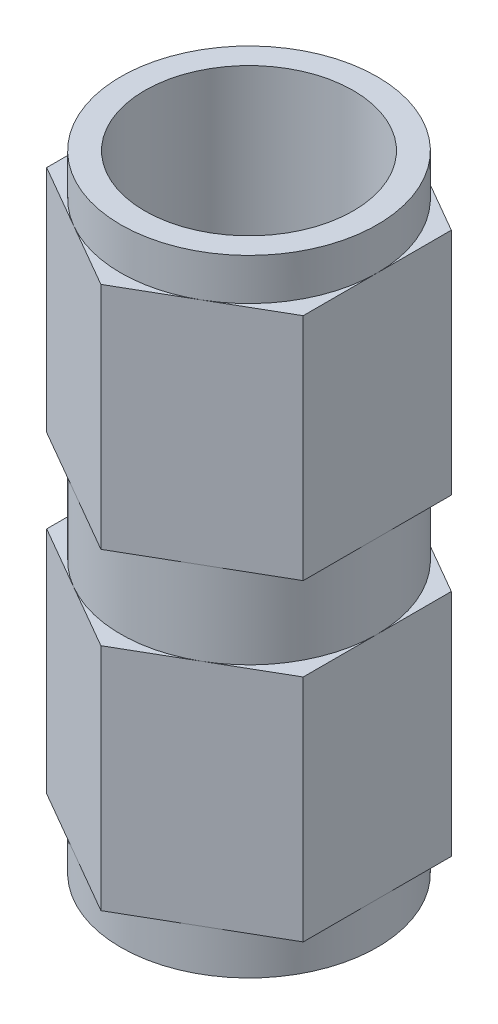
from build123d import *

# Parameters (mm, degrees)
SKETCH1_R               = 6.35
BOSS_EXTRUDE1_DEPTH     = 38.1
CUT_EXTRUDE1_DEPTH      = 2.54
CUT_EXTRUDE2_START      = -2.54
CUT_EXTRUDE2_DEPTH      = 2.54
CUT_EXTRUDE3_DEPTH      = 2.54
CUT_EXTRUDE3_DEPTH_BACK = 2.54
SKETCH5_R               = 11.357347969
SKETCH5_R_2             = 7.808951066


with BuildPart() as part:
    # Sketch1 → Boss-Extrude1 (new body)
    with BuildSketch(Plane(origin=(0, 0, 0), x_dir=(1, 0, 0), z_dir=(0, 1, 0))):
        Polygon((0, 9.017), (-7.808951066, 4.5085), (-7.808951066, -4.5085), (0, -9.017), (7.808951066, -4.5085), (7.808951066, 4.5085), align=None)
        with Locations(Location((0, 0, 0), (0, 0, 90))):
            Circle(SKETCH1_R, mode=Mode.SUBTRACT)
    extrude(amount=BOSS_EXTRUDE1_DEPTH)

    # Sketch3 → Cut-Extrude1 (cut)
    with BuildSketch(Plane.XZ):
        with BuildLine():
            Line((7.808951066, -4.5085), (7.808951066, 0))
            ThreePointArc((7.808951066, 0), (6.762749987, -3.904475555), (3.904475488, -6.762750026))
            Line((3.904475488, -6.762750026), (7.808951066, -4.5085))
        make_face()
        with BuildLine():
            ThreePointArc((3.904475554, 6.762749988), (6.762750006, 3.904475522), (7.808951066, 0))
            Line((7.808951066, 0), (7.808951066, 4.5085))
            Line((7.808951066, 4.5085), (3.904475554, 6.762749988))
        make_face()
        with BuildLine():
            ThreePointArc((-3.904475468, 6.762750038), (5e-08, 7.808951066), (3.904475554, 6.762749988))
            Line((3.904475554, 6.762749988), (0, 9.017))
            Line((0, 9.017), (-3.904475468, 6.762750038))
        make_face()
        with BuildLine():
            Line((0, -9.017), (3.904475488, -6.762750026))
            ThreePointArc((3.904475488, -6.762750026), (-3.8e-08, -7.808951066), (-3.904475554, -6.762749988))
            Line((-3.904475554, -6.762749988), (0, -9.017))
        make_face()
        with BuildLine():
            ThreePointArc((-7.808951066, 1.5e-08), (-6.762749977, 3.904475572), (-3.904475468, 6.762750038))
            Line((-3.904475468, 6.762750038), (-7.808951066, 4.5085))
            Line((-7.808951066, 4.5085), (-7.808951066, 1.5e-08))
        make_face()
        with BuildLine():
            Line((-7.808951066, -4.5085), (-3.904475554, -6.762749988))
            ThreePointArc((-3.904475554, -6.762749988), (-6.76275001, -3.904475516), (-7.808951066, 1.5e-08))
            Line((-7.808951066, 1.5e-08), (-7.808951066, -4.5085))
        make_face()
    extrude(amount=-CUT_EXTRUDE1_DEPTH, mode=Mode.SUBTRACT)

    # Sketch4 → Cut-Extrude2 (cut)
    with BuildSketch(Plane(origin=(0, 38.1, 0), x_dir=(1, 0, 0), z_dir=(0, 1, 0)).offset(CUT_EXTRUDE2_START)):
        with BuildLine():
            Line((-7.808951066, -4.5085), (-3.904475554, -6.762749988))
            ThreePointArc((-3.904475554, -6.762749988), (-6.762750002, -3.904475529), (-7.808951066, -1.5e-08))
            Line((-7.808951066, -1.5e-08), (-7.808951066, -4.5085))
        make_face()
        with BuildLine():
            Line((0, -9.017), (3.904475554, -6.762749988))
            ThreePointArc((3.904475554, -6.762749988), (0, -7.808951066), (-3.904475554, -6.762749988))
            Line((-3.904475554, -6.762749988), (0, -9.017))
        make_face()
        with BuildLine():
            ThreePointArc((-7.808951066, -1.5e-08), (-6.76275001, 3.904475516), (-3.904475554, 6.762749988))
            Line((-3.904475554, 6.762749988), (-7.808951066, 4.5085))
            Line((-7.808951066, 4.5085), (-7.808951066, -1.5e-08))
        make_face()
        with BuildLine():
            ThreePointArc((-3.904475554, 6.762749988), (-5e-08, 7.808951066), (3.904475468, 6.762750038))
            Line((3.904475468, 6.762750038), (0, 9.017))
            Line((0, 9.017), (-3.904475554, 6.762749988))
        make_face()
        with BuildLine():
            ThreePointArc((3.904475468, 6.762750038), (6.762749981, 3.904475566), (7.808951066, 0))
            Line((7.808951066, 0), (7.808951066, 4.5085))
            Line((7.808951066, 4.5085), (3.904475468, 6.762750038))
        make_face()
        with BuildLine():
            Line((7.808951066, -4.5085), (7.808951066, 0))
            ThreePointArc((7.808951066, 0), (6.762750006, -3.904475522), (3.904475554, -6.762749988))
            Line((3.904475554, -6.762749988), (7.808951066, -4.5085))
        make_face()
    extrude(amount=CUT_EXTRUDE2_DEPTH, mode=Mode.SUBTRACT)

    # Sketch5 → Cut-Extrude3 (cut, two sides: drawn at the far end of the back side and taken through both)
    with BuildSketch(Plane(origin=(0, 19.05, 0), x_dir=(-1, 0, 0), z_dir=(0, -1, 0)).offset(-CUT_EXTRUDE3_DEPTH_BACK)):
        Circle(SKETCH5_R)
        with Locations(Location((0, 0, 0), (0, 0, 90))):
            Circle(SKETCH5_R_2, mode=Mode.SUBTRACT)
    extrude(amount=CUT_EXTRUDE3_DEPTH + CUT_EXTRUDE3_DEPTH_BACK, mode=Mode.SUBTRACT)


solid = part.part
